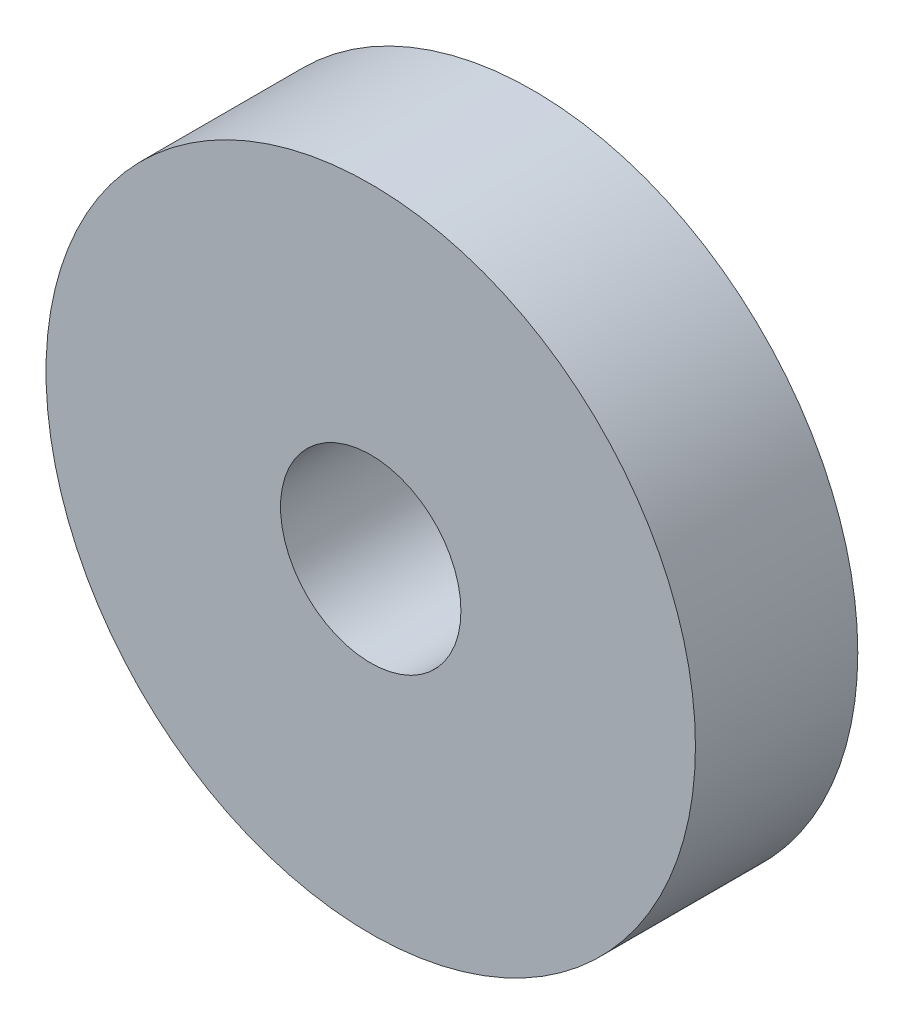
from build123d import *

# Parameters (mm, degrees)
ESQUISSE1_R          = 18
ESQUISSE1_R_2        = 5
BASE_EXTRUSION_DEPTH = 9


with BuildPart() as part:
    # Esquisse1 → Base-Extrusion (new body)
    with BuildSketch(Plane.XY):
        Circle(ESQUISSE1_R)
        Circle(ESQUISSE1_R_2, mode=Mode.SUBTRACT)
    extrude(amount=BASE_EXTRUSION_DEPTH)


solid = part.part
